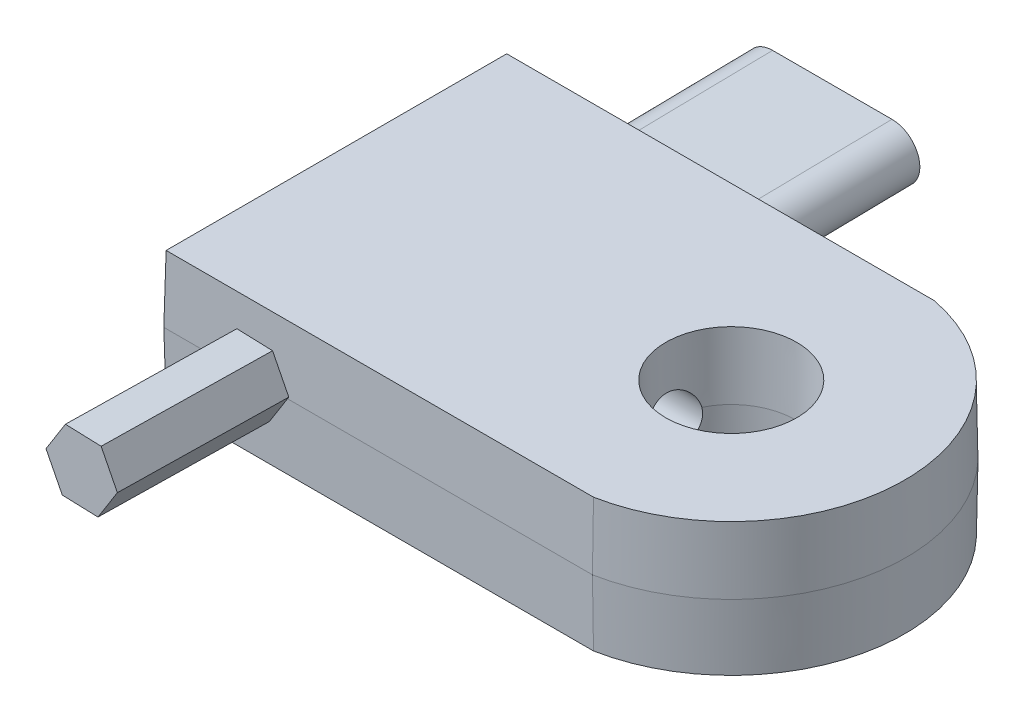
from build123d import *

# Parameters (mm, degrees)
SKETCH1_R                     = 15
BOSS_EXTRUDE1_DEPTH           = 15.54000612
BOSS_EXTRUDE1_DRAFT           = 1
BOSS_EXTRUDE1_OTHER_WAY_DEPTH = 15.54000612
BOSS_EXTRUDE1_OTHER_WAY_DRAFT = -1
SKETCH4_R                     = 6.744646555
CUT_EXTRUDE3_DEPTH            = 93.319796338
BOSS_EXTRUDE4_DEPTH           = 40
BOSS_EXTRUDE5_DEPTH           = 40


with BuildPart() as part:
    # Sketch1 → Boss-Extrude1 (with draft: the straight prism first)
    with BuildSketch(Plane(origin=(0, 0, 0), x_dir=(1, 0, 0), z_dir=(0, 1, 0))):
        with BuildLine():
            Line((-20.823660635, 37.109004739), (-20.823660635, -42.890995261))
            Line((-20.823660635, -42.890995261), (79.176339365, -42.890995261))
            ThreePointArc((79.176339365, -42.890995261), (112.281888642, -2.890995261), (79.176339365, 37.109004739))
            Line((79.176339365, 37.109004739), (-20.823660635, 37.109004739))
        make_face()
        with Locations((71.563981043, -2.890995261)):
            Circle(SKETCH1_R, mode=Mode.SUBTRACT)
    extrude(amount=BOSS_EXTRUDE1_DEPTH)
    # Boss-Extrude1: the draft: its side faces are tilted about the plane it starts from
    boss_extrude1_sides = [part.faces().sort_by_distance(p)[0] for p in [
        (29.176339365, 7.77000306, -37.109004739),
        (-20.823660635, 7.77000306, 2.890995261),
        (29.176339365, 7.77000306, 42.890995261),
        (112.281888642, 7.77000306, 2.890995261),
        (56.563981043, 7.77000306, 2.890995261),
    ]]
    draft(boss_extrude1_sides, Plane(origin=(0, 0, 0), x_dir=(1, 0, 0), z_dir=(0, 1, 0)), BOSS_EXTRUDE1_DRAFT)


with BuildPart() as boss_extrude1_other_way_tool:
    # Sketch1 → Boss-Extrude1 other way (with draft: the straight prism first)
    with BuildSketch(Plane(origin=(0, 0, 0), x_dir=(1, 0, 0), z_dir=(0, 1, 0))):
        with BuildLine():
            Line((-20.823660635, 37.109004739), (-20.823660635, -42.890995261))
            Line((-20.823660635, -42.890995261), (79.176339365, -42.890995261))
            ThreePointArc((79.176339365, -42.890995261), (112.281888642, -2.890995261), (79.176339365, 37.109004739))
            Line((79.176339365, 37.109004739), (-20.823660635, 37.109004739))
        make_face()
        with Locations((71.563981043, -2.890995261)):
            Circle(SKETCH1_R, mode=Mode.SUBTRACT)
    extrude(amount=-BOSS_EXTRUDE1_OTHER_WAY_DEPTH)
    # Boss-Extrude1 other way: the draft: its side faces are tilted about the plane it starts from
    boss_extrude1_other_way_sides = [boss_extrude1_other_way_tool.faces().sort_by_distance(p)[0] for p in [
        (29.176339365, -7.77000306, -37.109004739),
        (-20.823660635, -7.77000306, 2.890995261),
        (29.176339365, -7.77000306, 42.890995261),
        (112.281888642, -7.77000306, 2.890995261),
        (56.563981043, -7.77000306, 2.890995261),
    ]]
    draft(boss_extrude1_other_way_sides, Plane(origin=(0, 0, 0), x_dir=(1, 0, 0), z_dir=(0, 1, 0)), BOSS_EXTRUDE1_OTHER_WAY_DRAFT)


with BuildPart() as part_1:
    add(part.part)

    # Boss-Extrude1 other way: add boss_extrude1_other_way_tool
    add(boss_extrude1_other_way_tool.part)

    # Sketch4 → Cut-Extrude3 (cut)
    with BuildSketch(Plane(origin=(-20.817318029, 0.363367638, 0), x_dir=(0, 0, 1), z_dir=(-0.9998476951563913, 0.01745240643728355, 0))):
        with Locations((2.890995261, -0.363422989)):
            Circle(SKETCH4_R)
    extrude(amount=-CUT_EXTRUDE3_DEPTH, mode=Mode.SUBTRACT)

    # Sketch5 → Boss-Extrude4 (add)
    with BuildSketch(Plane(origin=(0, 0.647542794, -37.097701838), x_dir=(-1, 0, 0), z_dir=(0, 0.01745240643728355, -0.9998476951563913))):
        with BuildLine():
            Line((-29.176339365, 5.74353059), (-1.322649043, 5.74353059))
            ThreePointArc((-1.322649043, 5.74353059), (5.06852298, -0.647641433), (-1.322649043, -7.038813456))
            Line((-1.322649043, -7.038813456), (-29.176339365, -7.038813456))
            ThreePointArc((-29.176339365, -7.038813456), (-35.567511388, -0.647641433), (-29.176339365, 5.74353059))
        make_face()
    extrude(amount=BOSS_EXTRUDE4_DEPTH)

    # Sketch6 → Boss-Extrude5 (add)
    with BuildSketch(Plane(origin=(0, 0.748437074, 42.877931243), x_dir=(1, 0, 0), z_dir=(0, 0.017452406437283557, 0.9998476951563913))):
        Polygon((3.92205187, -7.356373004), (8.331831836, -0.281589948), (4.409779966, 7.074783056), (-3.92205187, 7.356373004), (-8.331831836, 0.281589948), (-4.409779966, -7.074783056), align=None)
    extrude(amount=BOSS_EXTRUDE5_DEPTH)


solid = part_1.part
